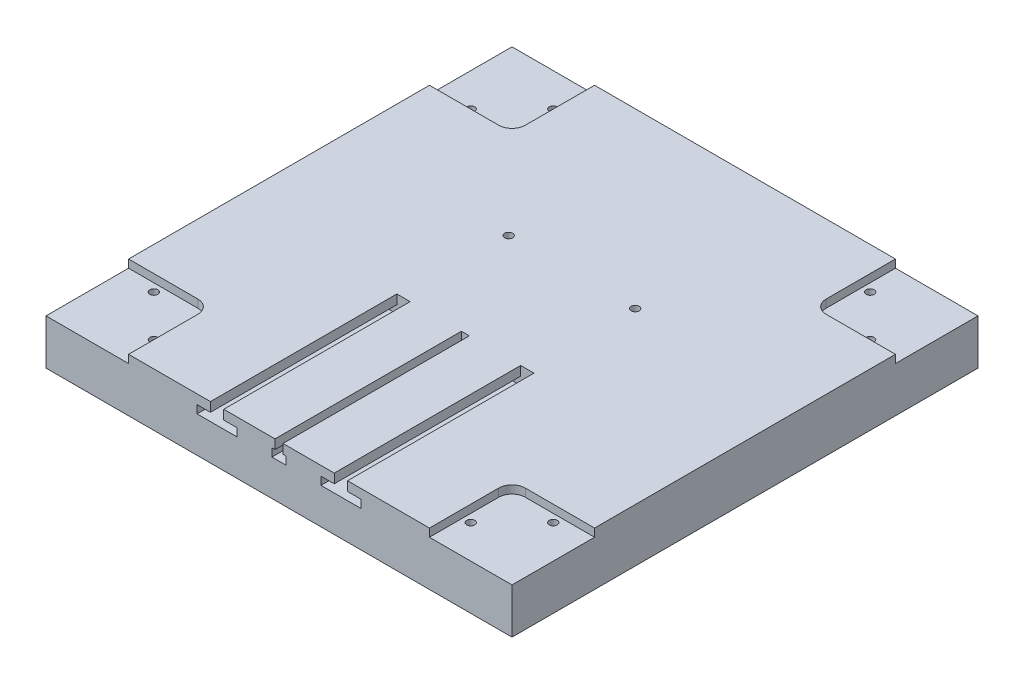
from build123d import *

# Parameters (mm, degrees)
SKETCH1_W           = 175
SKETCH1_H           = 175
BOSS_EXTRUDE2_DEPTH = 20
CUT_EXTRUDE6_DEPTH  = 3
CUT_EXTRUDE7_REACH  = 126.906
SKETCH8_R           = 1.5
CUT_EXTRUDE8_DEPTH  = 70
CUT_EXTRUDE9_REACH  = 127.35
SKETCH10_R          = 1.5


with BuildPart() as part:
    # Sketch1 → Boss-Extrude2 (new body)
    with BuildSketch(Plane(origin=(0, 0, 0), x_dir=(1, 0, 0), z_dir=(0, 1, 0))):
        Rectangle(SKETCH1_W, SKETCH1_H)
    extrude(amount=BOSS_EXTRUDE2_DEPTH)

    # Sketch7 → Cut-Extrude6 (cut)
    with BuildSketch(Plane(origin=(0, 20, 0), x_dir=(1, 0, 0), z_dir=(0, 1, 0))):
        with BuildLine():
            Line((-87.5, 87.5), (-56.5, 87.5))
            Line((-56.5, 87.5), (-56.5, 61.5))
            ThreePointArc((-56.5, 61.5), (-57.964466094, 57.964466094), (-61.5, 56.5))
            Line((-61.5, 56.5), (-87.5, 56.5))
            Line((-87.5, 56.5), (-87.5, 87.5))
        make_face()
        with BuildLine():
            Line((87.5, 56.5), (61.5, 56.5))
            ThreePointArc((61.5, 56.5), (57.964466094, 57.964466094), (56.5, 61.5))
            Line((56.5, 61.5), (56.5, 87.5))
            Line((56.5, 87.5), (87.5, 87.5))
            Line((87.5, 87.5), (87.5, 56.5))
        make_face()
        with BuildLine():
            Line((87.5, -87.5), (87.5, -56.5))
            Line((87.5, -56.5), (61.5, -56.5))
            ThreePointArc((61.5, -56.5), (57.964466094, -57.964466094), (56.5, -61.5))
            Line((56.5, -61.5), (56.5, -87.5))
            Line((56.5, -87.5), (87.5, -87.5))
        make_face()
        with BuildLine():
            Line((-56.5, -87.5), (-56.5, -61.5))
            ThreePointArc((-56.5, -61.5), (-57.964466094, -57.964466094), (-61.5, -56.5))
            Line((-61.5, -56.5), (-87.5, -56.5))
            Line((-87.5, -56.5), (-87.5, -87.5))
            Line((-87.5, -87.5), (-56.5, -87.5))
        make_face()
    extrude(amount=-CUT_EXTRUDE6_DEPTH, mode=Mode.SUBTRACT)

    # Sketch8 → Cut-Extrude7 (cut, up to next)
    with BuildSketch(Plane(origin=(0, 17, 0), x_dir=(1, 0, 0), z_dir=(0, 1, 0)), mode=Mode.PRIVATE) as cut_extrude7_sk1:
        with Locations(Location((-75, -59.5, 0), (0, 0, 270))):
            Circle(SKETCH8_R)
    cut_extrude7_tool1 = extrude(cut_extrude7_sk1.sketch, amount=-CUT_EXTRUDE7_REACH, mode=Mode.PRIVATE) & part.part
    # Sketch8 → Cut-Extrude7 (cut, up to next)
    with BuildSketch(Plane(origin=(0, 17, 0), x_dir=(1, 0, 0), z_dir=(0, 1, 0)), mode=Mode.PRIVATE) as cut_extrude7_sk2:
        with Locations(Location((-59.5, -75, 0), (0, 0, 270))):
            Circle(SKETCH8_R)
    cut_extrude7_tool2 = extrude(cut_extrude7_sk2.sketch, amount=-CUT_EXTRUDE7_REACH, mode=Mode.PRIVATE) & part.part
    # Sketch8 → Cut-Extrude7 (cut, up to next)
    with BuildSketch(Plane(origin=(0, 17, 0), x_dir=(1, 0, 0), z_dir=(0, 1, 0)), mode=Mode.PRIVATE) as cut_extrude7_sk3:
        with Locations(Location((59.5, -75, 0), (0, 0, 270))):
            Circle(SKETCH8_R)
    cut_extrude7_tool3 = extrude(cut_extrude7_sk3.sketch, amount=-CUT_EXTRUDE7_REACH, mode=Mode.PRIVATE) & part.part
    # Sketch8 → Cut-Extrude7 (cut, up to next)
    with BuildSketch(Plane(origin=(0, 17, 0), x_dir=(1, 0, 0), z_dir=(0, 1, 0)), mode=Mode.PRIVATE) as cut_extrude7_sk4:
        with Locations(Location((75, -59.5, 0), (0, 0, 270))):
            Circle(SKETCH8_R)
    cut_extrude7_tool4 = extrude(cut_extrude7_sk4.sketch, amount=-CUT_EXTRUDE7_REACH, mode=Mode.PRIVATE) & part.part
    # Sketch8 → Cut-Extrude7 (cut, up to next)
    with BuildSketch(Plane(origin=(0, 17, 0), x_dir=(1, 0, 0), z_dir=(0, 1, 0)), mode=Mode.PRIVATE) as cut_extrude7_sk5:
        with Locations(Location((59.5, 75, 0), (0, 0, 270))):
            Circle(SKETCH8_R)
    cut_extrude7_tool5 = extrude(cut_extrude7_sk5.sketch, amount=-CUT_EXTRUDE7_REACH, mode=Mode.PRIVATE) & part.part
    # Sketch8 → Cut-Extrude7 (cut, up to next)
    with BuildSketch(Plane(origin=(0, 17, 0), x_dir=(1, 0, 0), z_dir=(0, 1, 0)), mode=Mode.PRIVATE) as cut_extrude7_sk6:
        with Locations(Location((75, 59.5, 0), (0, 0, 270))):
            Circle(SKETCH8_R)
    cut_extrude7_tool6 = extrude(cut_extrude7_sk6.sketch, amount=-CUT_EXTRUDE7_REACH, mode=Mode.PRIVATE) & part.part
    # Sketch8 → Cut-Extrude7 (cut, up to next)
    with BuildSketch(Plane(origin=(0, 17, 0), x_dir=(1, 0, 0), z_dir=(0, 1, 0)), mode=Mode.PRIVATE) as cut_extrude7_sk7:
        with Locations(Location((-59.5, 75, 0), (0, 0, 270))):
            Circle(SKETCH8_R)
    cut_extrude7_tool7 = extrude(cut_extrude7_sk7.sketch, amount=-CUT_EXTRUDE7_REACH, mode=Mode.PRIVATE) & part.part
    # Sketch8 → Cut-Extrude7 (cut, up to next)
    with BuildSketch(Plane(origin=(0, 17, 0), x_dir=(1, 0, 0), z_dir=(0, 1, 0)), mode=Mode.PRIVATE) as cut_extrude7_sk8:
        with Locations(Location((-75, 59.5, 0), (0, 0, 270))):
            Circle(SKETCH8_R)
    cut_extrude7_tool8 = extrude(cut_extrude7_sk8.sketch, amount=-CUT_EXTRUDE7_REACH, mode=Mode.PRIVATE) & part.part
    add(cut_extrude7_tool1.solids().sort_by_distance((-75, 17, 59.5))[0], mode=Mode.SUBTRACT)
    add(cut_extrude7_tool2.solids().sort_by_distance((-59.5, 17, 75))[0], mode=Mode.SUBTRACT)
    add(cut_extrude7_tool3.solids().sort_by_distance((59.5, 17, 75))[0], mode=Mode.SUBTRACT)
    add(cut_extrude7_tool4.solids().sort_by_distance((75, 17, 59.5))[0], mode=Mode.SUBTRACT)
    add(cut_extrude7_tool5.solids().sort_by_distance((59.5, 17, -75))[0], mode=Mode.SUBTRACT)
    add(cut_extrude7_tool6.solids().sort_by_distance((75, 17, -59.5))[0], mode=Mode.SUBTRACT)
    add(cut_extrude7_tool7.solids().sort_by_distance((-59.5, 17, -75))[0], mode=Mode.SUBTRACT)
    add(cut_extrude7_tool8.solids().sort_by_distance((-75, 17, -59.5))[0], mode=Mode.SUBTRACT)

    # Sketch9 → Cut-Extrude8 (cut)
    with BuildSketch(Plane.XY.offset(87.5)):
        Polygon((-20.75, 20), (-25.75, 20), (-25.75, 16.5), (-30.75, 16.5), (-30.75, 13.5), (-15.75, 13.5), (-15.75, 16.5), (-20.75, 16.5), align=None)
        Polygon((25.75, 16.5), (25.75, 20), (20.75, 20), (20.75, 16.5), (15.75, 16.5), (15.75, 13.5), (30.75, 13.5), (30.75, 16.5), align=None)
        Polygon((-2.65, 16.5), (-1.5, 16.5), (-1.5, 20), (1.5, 20), (1.5, 16.5), (2.65, 16.5), (2.65, 13.5), (-2.65, 13.5), align=None)
    extrude(amount=-CUT_EXTRUDE8_DEPTH, mode=Mode.SUBTRACT)

    # Sketch10 → Cut-Extrude9 (cut, up to next)
    with BuildSketch(Plane(origin=(0, 20, 0), x_dir=(1, 0, 0), z_dir=(0, 1, 0)), mode=Mode.PRIVATE) as cut_extrude9_sk1:
        with Locations(Location((-23.75, 22.5, 0), (0, 0, 270))):
            Circle(SKETCH10_R)
    cut_extrude9_tool1 = extrude(cut_extrude9_sk1.sketch, amount=-CUT_EXTRUDE9_REACH, mode=Mode.PRIVATE) & part.part
    # Sketch10 → Cut-Extrude9 (cut, up to next)
    with BuildSketch(Plane(origin=(0, 20, 0), x_dir=(1, 0, 0), z_dir=(0, 1, 0)), mode=Mode.PRIVATE) as cut_extrude9_sk2:
        with Locations(Location((23.75, 22.5, 0), (0, 0, 270))):
            Circle(SKETCH10_R)
    cut_extrude9_tool2 = extrude(cut_extrude9_sk2.sketch, amount=-CUT_EXTRUDE9_REACH, mode=Mode.PRIVATE) & part.part
    add(cut_extrude9_tool1.solids().sort_by_distance((-23.75, 20, -22.5))[0], mode=Mode.SUBTRACT)
    add(cut_extrude9_tool2.solids().sort_by_distance((23.75, 20, -22.5))[0], mode=Mode.SUBTRACT)


solid = part.part
